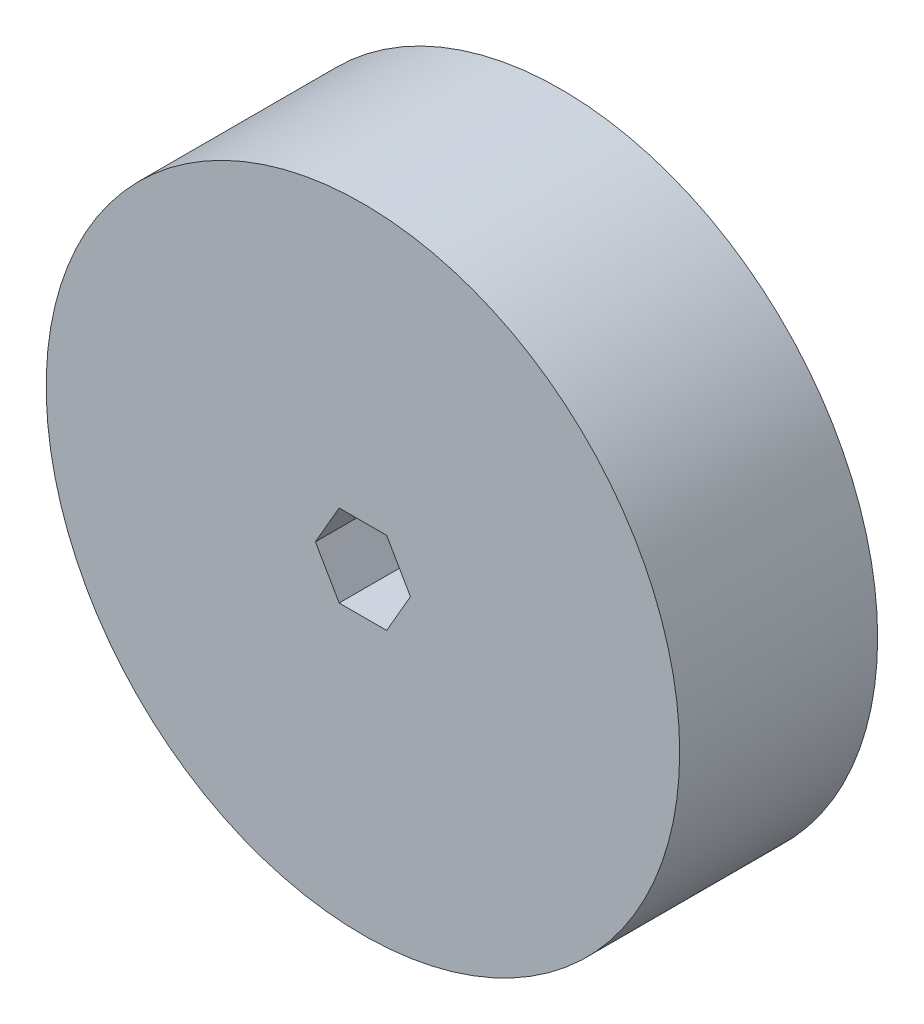
from build123d import *

# Parameters (mm, degrees)
SKETCH1_R           = 24
BOSS_EXTRUDE1_DEPTH = 15
CUT_EXTRUDE1_DEPTH  = 38.107950631
SCALE1_SCALE        = 0.75


with BuildPart() as part:
    # Sketch1 → Boss-Extrude1 (new body)
    with BuildSketch(Plane.XY):
        Circle(SKETCH1_R)
    extrude(amount=BOSS_EXTRUDE1_DEPTH)

    # Sketch2 → Cut-Extrude1 (cut, through all)
    with BuildSketch(Plane.XY.offset(15)):
        Polygon((3.6, 0), (1.8, 3.117691454), (-1.8, 3.117691454), (-3.6, 0), (-1.8, -3.117691454), (1.8, -3.117691454), align=None)
    extrude(amount=-CUT_EXTRUDE1_DEPTH, mode=Mode.SUBTRACT)


with BuildPart() as part_1:
    # Scale1: scaled about (0, 0, 7.5)
    add(part.part.scale(SCALE1_SCALE).moved(Location((0, 0, 1.875))))


solid = part_1.part
